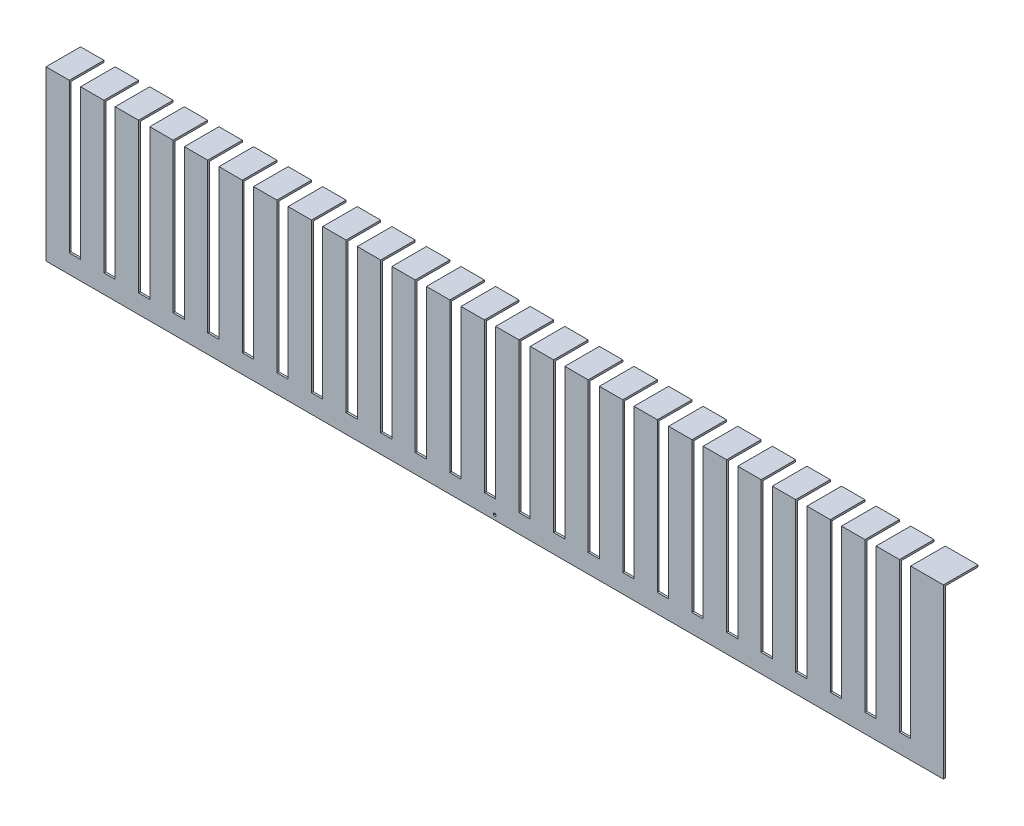
from build123d import *

# Parameters (mm, degrees)
SKETCH1_R           = 1.5
BOSS_EXTRUDE1_DEPTH = 2
SKETCH4_W           = 25
SKETCH4_H           = 35
SKETCH4_W_2         = 35
BOSS_EXTRUDE4_DEPTH = 2
BOSS_EXTRUDE5_START = -2
BOSS_EXTRUDE5_DEPTH = 2


with BuildPart() as part:
    # Sketch1 → Boss-Extrude1 (new body)
    with BuildSketch(Plane.XY):
        Polygon((-480, 80), (-455, 80), (-455, -80), (-443, -80), (-443, 80), (-418, 80), (-418, -80), (-406, -80), (-406, 80), (-381, 80), (-381, -80), (-369, -80), (-369, 80), (-344, 80), (-344, -80), (-332, -80), (-332, 80), (-307, 80), (-307, -80), (-295, -80), (-295, 80), (-270, 80), (-270, -80), (-258, -80), (-258, 80), (-233, 80), (-233, -80), (-221, -80), (-221, 80), (-196, 80), (-196, -80), (-184, -80), (-184, 80), (-159, 80), (-159, -80), (-147, -80), (-147, 80), (-122, 80), (-122, -80), (-110, -80), (-110, 80), (-85, 80), (-85, -80), (-73, -80), (-73, 80), (-48, 80), (-48, -80), (-36, -80), (-36, 80), (-11, 80), (-11, -80), (1, -80), (1, 80), (26, 80), (26, -80), (38, -80), (38, 80), (63, 80), (63, -80), (75, -80), (75, 80), (100, 80), (100, -80), (112, -80), (112, 80), (137, 80), (137, -80), (149, -80), (149, 80), (174, 80), (174, -80), (186, -80), (186, 80), (211, 80), (211, -80), (223, -80), (223, 80), (248, 80), (248, -80), (260, -80), (260, 80), (285, 80), (285, -80), (297, -80), (297, 80), (322, 80), (322, -80), (334, -80), (334, 80), (359, 80), (359, -80), (371, -80), (371, 80), (396, 80), (396, -80), (408, -80), (408, 80), (433, 80), (433, -80), (445, -80), (445, 80), (480, 80), (480, -100), (-480, -100), align=None)
        with Locations((0, -95)):
            Circle(SKETCH1_R, mode=Mode.SUBTRACT)
    extrude(amount=BOSS_EXTRUDE1_DEPTH)

    # Sketch4 → Boss-Extrude4 (add)
    with BuildSketch(Plane(origin=(0, 80, 0), x_dir=(1, 0, 0), z_dir=(0, 1, 0))):
        with Locations((-430.5, 17.5)):
            Rectangle(SKETCH4_W, SKETCH4_H)
        with Locations((-467.5, 17.5)):
            Rectangle(SKETCH4_W, SKETCH4_H)
        with Locations((-393.5, 17.5)):
            Rectangle(SKETCH4_W, SKETCH4_H)
        with Locations((-356.5, 17.5)):
            Rectangle(SKETCH4_W, SKETCH4_H)
        with Locations((-319.5, 17.5)):
            Rectangle(SKETCH4_W, SKETCH4_H)
        with Locations((-282.5, 17.5)):
            Rectangle(SKETCH4_W, SKETCH4_H)
        with Locations((-245.5, 17.5)):
            Rectangle(SKETCH4_W, SKETCH4_H)
        with Locations((-208.5, 17.5)):
            Rectangle(SKETCH4_W, SKETCH4_H)
        with Locations((-171.5, 17.5)):
            Rectangle(SKETCH4_W, SKETCH4_H)
        with Locations((-134.5, 17.5)):
            Rectangle(SKETCH4_W, SKETCH4_H)
        with Locations((-97.5, 17.5)):
            Rectangle(SKETCH4_W, SKETCH4_H)
        with Locations((-60.5, 17.5)):
            Rectangle(SKETCH4_W, SKETCH4_H)
        with Locations((-23.5, 17.5)):
            Rectangle(SKETCH4_W, SKETCH4_H)
        with Locations((13.5, 17.5)):
            Rectangle(SKETCH4_W, SKETCH4_H)
        with Locations((50.5, 17.5)):
            Rectangle(SKETCH4_W, SKETCH4_H)
        with Locations((87.5, 17.5)):
            Rectangle(SKETCH4_W, SKETCH4_H)
        with Locations((124.5, 17.5)):
            Rectangle(SKETCH4_W, SKETCH4_H)
        with Locations((161.5, 17.5)):
            Rectangle(SKETCH4_W, SKETCH4_H)
        with Locations((198.5, 17.5)):
            Rectangle(SKETCH4_W, SKETCH4_H)
        with Locations((235.5, 17.5)):
            Rectangle(SKETCH4_W, SKETCH4_H)
        with Locations((272.5, 17.5)):
            Rectangle(SKETCH4_W, SKETCH4_H)
        with Locations((309.5, 17.5)):
            Rectangle(SKETCH4_W, SKETCH4_H)
        with Locations((346.5, 17.5)):
            Rectangle(SKETCH4_W, SKETCH4_H)
        with Locations((383.5, 17.5)):
            Rectangle(SKETCH4_W, SKETCH4_H)
        with Locations((420.5, 17.5)):
            Rectangle(SKETCH4_W, SKETCH4_H)
        with Locations((462.5, 17.5)):
            Rectangle(SKETCH4_W_2, SKETCH4_H)
    extrude(amount=-BOSS_EXTRUDE4_DEPTH)

    # Sketch5 → Boss-Extrude5 (add)
    with BuildSketch(Plane.XY.offset(2).offset(BOSS_EXTRUDE5_START)):
        with BuildLine():
            Line((0, -95), (0.513030215, -93.590461069))
            ThreePointArc((0.513030215, -93.590461069), (0, -93.5), (-0.513030215, -93.590461069))
            Line((-0.513030215, -93.590461069), (0, -95))
        make_face()
    extrude(amount=BOSS_EXTRUDE5_DEPTH)


solid = part.part
